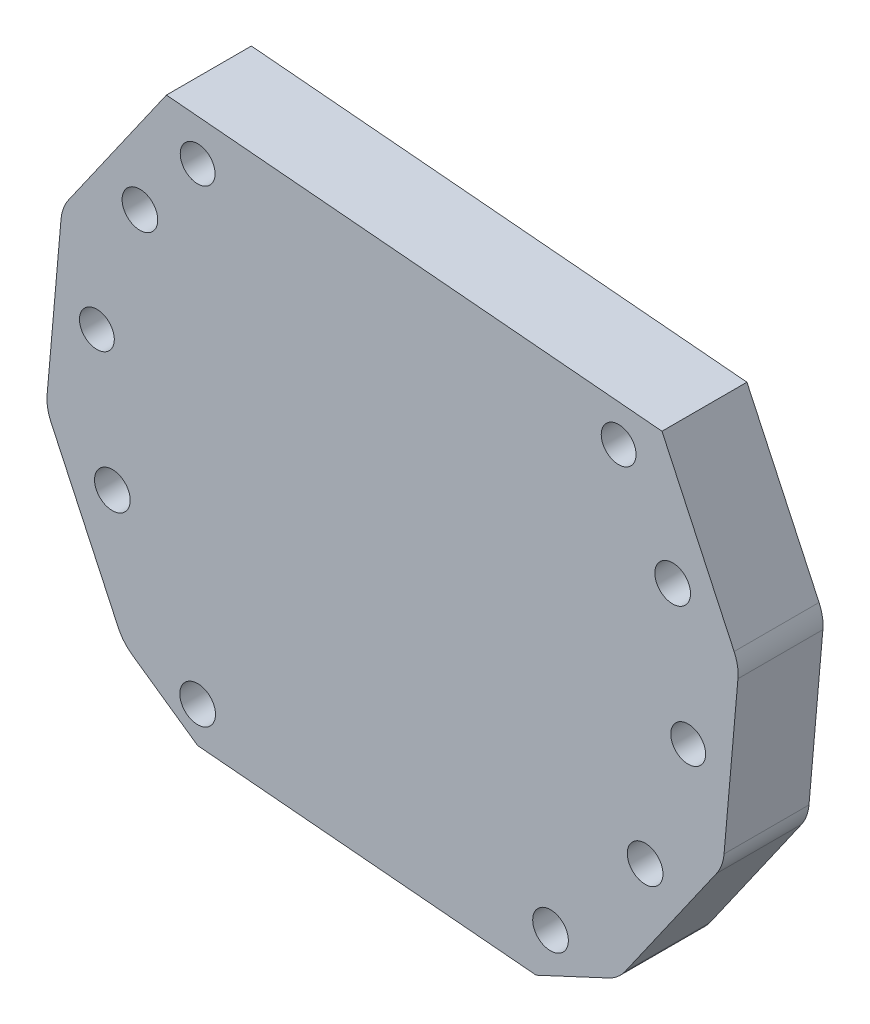
from build123d import *

# Parameters (mm, degrees)
BOSS_EXTRU_1_DEPTH      = 10
ESQUISSE3_R             = 2.05
ESQUISSE3_R_2           = 2.1
ENL_V_MAT_EXTRU_1_DEPTH = 56.474274361
CONG_1_R                = 5


with BuildPart() as part:
    # Esquisse1 → Boss.-Extru.1 (new body)
    with BuildSketch(Plane.XY):
        Polygon((16.90473047, -36.252311481), (26.618508055, -31.722702604), (38.913655488, -14.163412304), (40.781920359, 7.190952884), (31.722702604, 26.618508055), (-26.618508055, 31.722702604), (-38.913655488, 14.163412304), (-40.781920359, -7.190952884), (-31.722702604, -26.618508055), (-22.943057454, -32.766081772), align=None)
    extrude(amount=BOSS_EXTRU_1_DEPTH)

    # Esquisse3 → Enlèv. mat.-Extru.1 (cut, through all)
    with BuildSketch(Plane(origin=(0, 0, 0), x_dir=(-1, 0, 0), z_dir=(0, 0, -1))):
        with Locations((-26.618508055, 22.705871893)):
            Circle(ESQUISSE3_R)
        with Locations((22.943057454, 26.554275329)):
            Circle(ESQUISSE3_R)
        with Locations((29.737818366, 18.469938184)):
            Circle(ESQUISSE3_R_2)
        with Locations((34.806654387, 3.73808347)):
            Circle(ESQUISSE3_R)
        with Locations((32.981605632, -11.73414452)):
            Circle(ESQUISSE3_R_2)
        with Locations((22.943057454, -28.537832938)):
            Circle(ESQUISSE3_R_2)
        with Locations((-18.601253659, -30.822032576)):
            Circle(ESQUISSE3_R_2)
        with Locations((-29.737818366, -18.469938184)):
            Circle(ESQUISSE3_R_2)
        with Locations((-34.806654387, -3.73808347)):
            Circle(ESQUISSE3_R)
        with Locations((-32.981605632, 11.73414452)):
            Circle(ESQUISSE3_R_2)
    extrude(amount=-ENL_V_MAT_EXTRU_1_DEPTH, mode=Mode.SUBTRACT)

    # Congé1
    cong_1_edges = [part.edges().sort_by_distance(p)[0] for p in [
        (40.781920359, 7.190952884, 5),
        (38.913655488, -14.163412304, 5),
        (26.618508055, -31.722702604, 5),
        (-31.722702604, -26.618508055, 5),
        (-40.781920359, -7.190952884, 5),
        (-38.913655488, 14.163412304, 5),
    ]]
    fillet(cong_1_edges, radius=CONG_1_R)


solid = part.part
